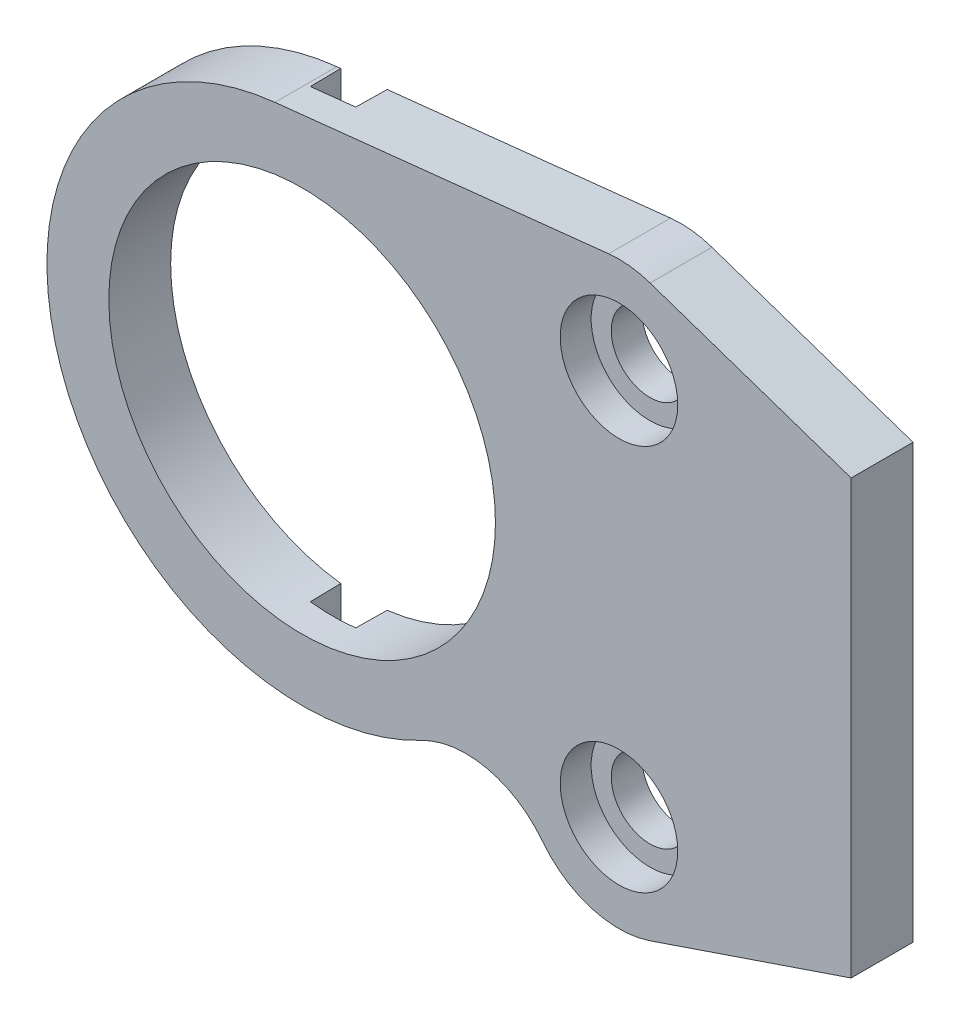
from build123d import *

# Parameters (mm, degrees)
SKETCH_1_R                = 33
SKETCH_1_R_2              = 25
EXTRUDE_1_DEPTH           = 8
SKETCH_3_W                = 6
SKETCH_3_H                = 75.065219084
CUT_EXTRUDE_1_DEPTH       = 4
CUT_EXTRUDE_1_DRAFT       = -1
HOLE_WIZARD_1_D           = 10
HOLE_WIZARD_1_CBORE_D     = 15.2
HOLE_WIZARD_1_CBORE_DEPTH = 4


with BuildPart() as part:
    # 草图1 → 凸台-拉伸1 (new body)
    # profile 1 of 2: a face of its own
    with BuildSketch(Plane.XY):
        Circle(SKETCH_1_R)
        Circle(SKETCH_1_R_2, mode=Mode.SUBTRACT)
    # profile 2 of 2: a face of its own
    with BuildSketch(Plane.XY):
        with BuildLine():
            Line((39.646094734, 37.429095265), (-3.509900495, 32.8128115))
            ThreePointArc((-3.509900495, 32.8128115), (22.058708979, 24.544110458), (33, 0))
            ThreePointArc((33, 0), (28.248342415, -17.059635132), (15.361748435, -29.206449374))
            ThreePointArc((15.361748435, -29.206449374), (23.844645568, -28.056684557), (31.078097518, -32.63474919))
            ThreePointArc((31.078097518, -32.63474919), (37.364061613, -36.96690321), (44.997122438, -36.835428905))
            Line((44.997122438, -36.835428905), (71, -28))
            Line((71, -28), (71, 28))
            Line((71, 28), (44.997122438, 36.835428905))
            ThreePointArc((44.997122438, 36.835428905), (42.353950178, 37.42377389), (39.646094734, 37.429095265))
        make_face()
    extrude(amount=EXTRUDE_1_DEPTH)


with BuildPart() as cut_extrude_1_tool:
    # 草图3 → 切除-拉伸-薄壁1 (with draft: the straight prism first)
    with BuildSketch(Plane(origin=(0, 0, 0), x_dir=(-1, 0, 0), z_dir=(0, 0, -1))):
        with Locations((0, -0.589324586)):
            Rectangle(SKETCH_3_W, SKETCH_3_H)
    extrude(amount=-CUT_EXTRUDE_1_DEPTH)
    # 切除-拉伸-薄壁1: the draft: its side faces are tilted about the plane it starts from
    cut_extrude_1_sides = [cut_extrude_1_tool.faces().sort_by_distance(p)[0] for p in [
        (3, -0.589324586, 2),
        (0, -38.121934128, 2),
        (-3, -0.589324586, 2),
        (0, 36.943284956, 2),
    ]]
    draft(cut_extrude_1_sides, Plane(origin=(0, 0, 0), x_dir=(-1, 0, 0), z_dir=(0, 0, -1)), CUT_EXTRUDE_1_DRAFT)


with BuildPart() as part_1:
    add(part.part)

    # 切除-拉伸-薄壁1: cut by cut_extrude_1_tool
    add(cut_extrude_1_tool.part, mode=Mode.SUBTRACT)

    # 孔1 (through all)
    with Locations(Plane.XY.offset(8)):
        with Locations((40.975602497, 25), (40.975602497, -25)):
            CounterBoreHole(HOLE_WIZARD_1_D / 2, HOLE_WIZARD_1_CBORE_D / 2, HOLE_WIZARD_1_CBORE_DEPTH)


solid = part_1.part
